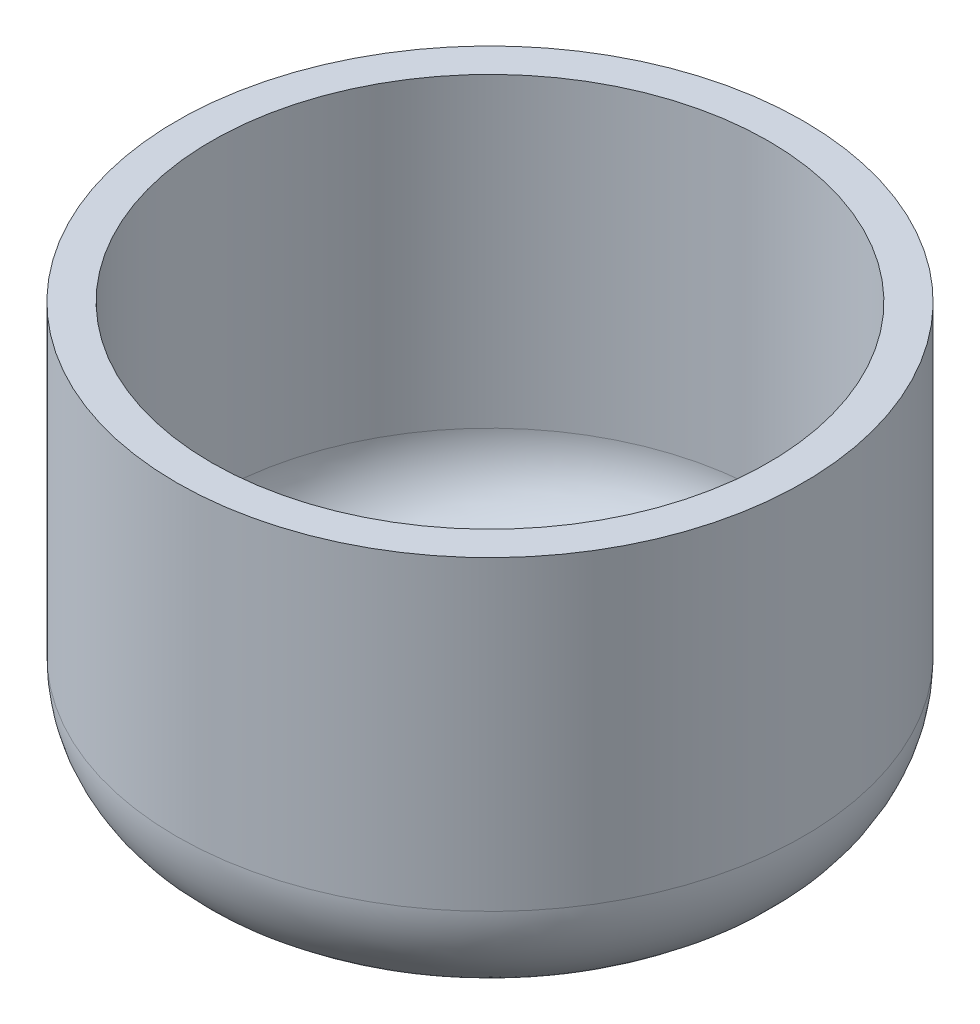
from build123d import *

# Parameters (mm, degrees)
SKETCH1_R                 = 14.2875
BOSS_EXTRUDE1_DEPTH       = 19.05
FILLET1_R                 = 5.08
SHELL1_T                  = -1.5875
F_8_CLEARANCE_HOLE1_D     = 4.4958
F_8_CLEARANCE_HOLE1_DEPTH = 6.35
F_8_CLEARANCE_HOLE1_TIP   = 1.350674586


with BuildPart() as part:
    # Sketch1 → Boss-Extrude1 (new body)
    with BuildSketch(Plane(origin=(0, 0, 0), x_dir=(1, 0, 0), z_dir=(0, 1, 0))):
        with Locations(Location((0, 0, 0), (0, 0, 90))):
            Circle(SKETCH1_R)
    extrude(amount=BOSS_EXTRUDE1_DEPTH)

    # Fillet1
    fillet1_edges = [part.edges().sort_by_distance(p)[0] for p in [
        (0, 0, 14.2875),
    ]]
    fillet(fillet1_edges, radius=FILLET1_R)

    # Shell1
    shell1_openings = [part.faces().sort_by_distance(p)[0] for p in [
        (0, 19.05, 0),
    ]]
    offset(amount=SHELL1_T, openings=shell1_openings, kind=Kind.INTERSECTION)

    # #8 Clearance Hole1
    with Locations(Plane(origin=(0, 1.5875, 0), x_dir=(1, 0, 0), z_dir=(0, 1, 0))):
        with Locations((0, 0)):
            Hole(F_8_CLEARANCE_HOLE1_D / 2, depth=F_8_CLEARANCE_HOLE1_DEPTH)
            with Locations((0, 0, -(F_8_CLEARANCE_HOLE1_DEPTH + F_8_CLEARANCE_HOLE1_TIP / 2))):  # 118° drill point
                Cone(0, F_8_CLEARANCE_HOLE1_D / 2, F_8_CLEARANCE_HOLE1_TIP, mode=Mode.SUBTRACT)


solid = part.part
